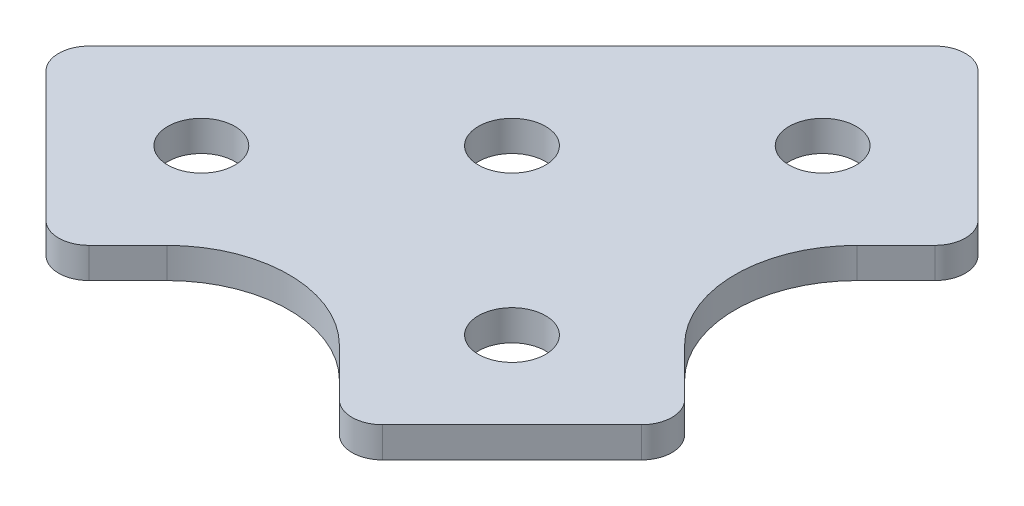
from build123d import *

# Parameters (mm, degrees)
BOSS_EXTRUDE1_DEPTH = 3.175
SKETCH2_R           = 3.4925
CUT_EXTRUDE2_DEPTH  = 3.175
LPATTERN5_COUNT     = 3
LPATTERN5_PITCH     = 22.86
SKETCH7_R           = 3.4925
CUT_EXTRUDE3_DEPTH  = 3.175
LPATTERN6_COUNT     = 2
LPATTERN6_PITCH     = 22.86
SKETCH8_R           = 3.4925
CUT_EXTRUDE4_DEPTH  = 85.115331985
FILLET3_R           = 12.7
FILLET4_R           = 3.175


with BuildPart() as part:
    # Sketch1 → Boss-Extrude1 (new body)
    with BuildSketch(Plane(origin=(0, 0, 0), x_dir=(1, 0, 0), z_dir=(0, 1, 0))):
        Polygon((-17.960512242, 17.960512242), (0, 35.921024484), (17.960512242, 17.960512242), (50.289434278, -14.368409794), (32.328922036, -32.328922036), (0, 0), (-31.430896424, -31.430896424), (-49.391408666, -13.470384182), align=None)
    extrude(amount=BOSS_EXTRUDE1_DEPTH)

    # Sketch2 → Cut-Extrude2 (cut)
    with BuildSketch(Plane(origin=(0, 3.175, 0), x_dir=(1, 0, 0), z_dir=(0, 1, 0))):
        with Locations(Location((-32.328922036, -14.368409794, 0), (0, 0, 270))):
            Circle(SKETCH2_R)
    cut_extrude2 = extrude(amount=-CUT_EXTRUDE2_DEPTH, mode=Mode.SUBTRACT)

    # LPattern5: Cut-Extrude2 ×3
    with Locations(*[Vector(0.7071067811865467, 0, -0.7071067811865485) * (i * LPATTERN5_PITCH) for i in range(1, LPATTERN5_COUNT)]):
        add(cut_extrude2, mode=Mode.SUBTRACT)

    # Sketch7 → Cut-Extrude3 (cut)
    with BuildSketch(Plane(origin=(0, 3.175, 0), x_dir=(1, 0, 0), z_dir=(0, 1, 0))):
        with Locations(Location((33.226947648, -15.266435406, 0), (0, 0, 270))):
            Circle(SKETCH7_R)
    cut_extrude3 = extrude(amount=-CUT_EXTRUDE3_DEPTH, mode=Mode.SUBTRACT)

    # LPattern6: Cut-Extrude3 ×2
    with Locations(*[Vector(-0.7071067811865457, 0, -0.7071067811865493) * (i * LPATTERN6_PITCH) for i in range(1, LPATTERN6_COUNT)]):
        add(cut_extrude3, mode=Mode.SUBTRACT)

    # Mirror2: part across plane


with BuildPart() as part_1:
    add(part.part)
    add(part.part.mirror(Plane(origin=(8.980256121, 0, -8.980256121), x_dir=(0.7071067811865464, 0, 0.7071067811865487), z_dir=(-0.7071067811865489, 0, 0.7071067811865462))))

    # Sketch8 → Cut-Extrude4 (cut, through all)
    # profile 1 of 3: a face of its own
    with BuildSketch(Plane(origin=(0, 3.175, 0), x_dir=(1, 0, 0), z_dir=(0, 1, 0))):
        Polygon((-15.266435406, -15.266435406), (-33.226947648, 2.694076836), (-49.391408666, -13.470384182), (-31.430896424, -31.430896424), align=None)
        with Locations((-32.328922036, -14.368409794)):
            Circle(SKETCH8_R, mode=Mode.SUBTRACT)
    # profile 2 of 3: a face of its own
    with BuildSketch(Plane(origin=(0, 3.175, 0), x_dir=(1, 0, 0), z_dir=(0, 1, 0))):
        Polygon((33.226947648, 33.226947648), (49.391408666, 49.391408666), (31.430896424, 67.351920908), (15.266435406, 51.18745989), align=None)
        with Locations((32.328922036, 50.289434278)):
            Circle(SKETCH8_R, mode=Mode.SUBTRACT)
    # profile 3 of 3: a face of its own
    with BuildSketch(Plane(origin=(0, 3.175, 0), x_dir=(1, 0, 0), z_dir=(0, 1, 0))):
        Polygon((50.289434278, -14.368409794), (34.12497326, 1.796051224), (16.164461018, -16.164461018), (32.328922036, -32.328922036), align=None)
        with Locations((33.226947648, -15.266435406)):
            Circle(SKETCH8_R, mode=Mode.SUBTRACT)
    extrude(amount=-CUT_EXTRUDE4_DEPTH, mode=Mode.SUBTRACT)

    # Fillet3
    fillet3_edges = [part_1.edges().sort_by_distance(p)[0] for p in [
        (0, 1.5875, 0),
        (17.960512242, 1.5875, -17.960512242),
    ]]
    fillet(fillet3_edges, radius=FILLET3_R)

    # Fillet4
    fillet4_edges = [part_1.edges().sort_by_distance(p)[0] for p in [
        (-33.226947648, 1.5875, -2.694076836),
        (-15.266435406, 1.5875, 15.266435406),
        (15.266435406, 1.5875, -51.18745989),
        (33.226947648, 1.5875, -33.226947648),
        (16.164461018, 1.5875, 16.164461018),
        (34.12497326, 1.5875, -1.796051224),
    ]]
    fillet(fillet4_edges, radius=FILLET4_R)


solid = part_1.part
